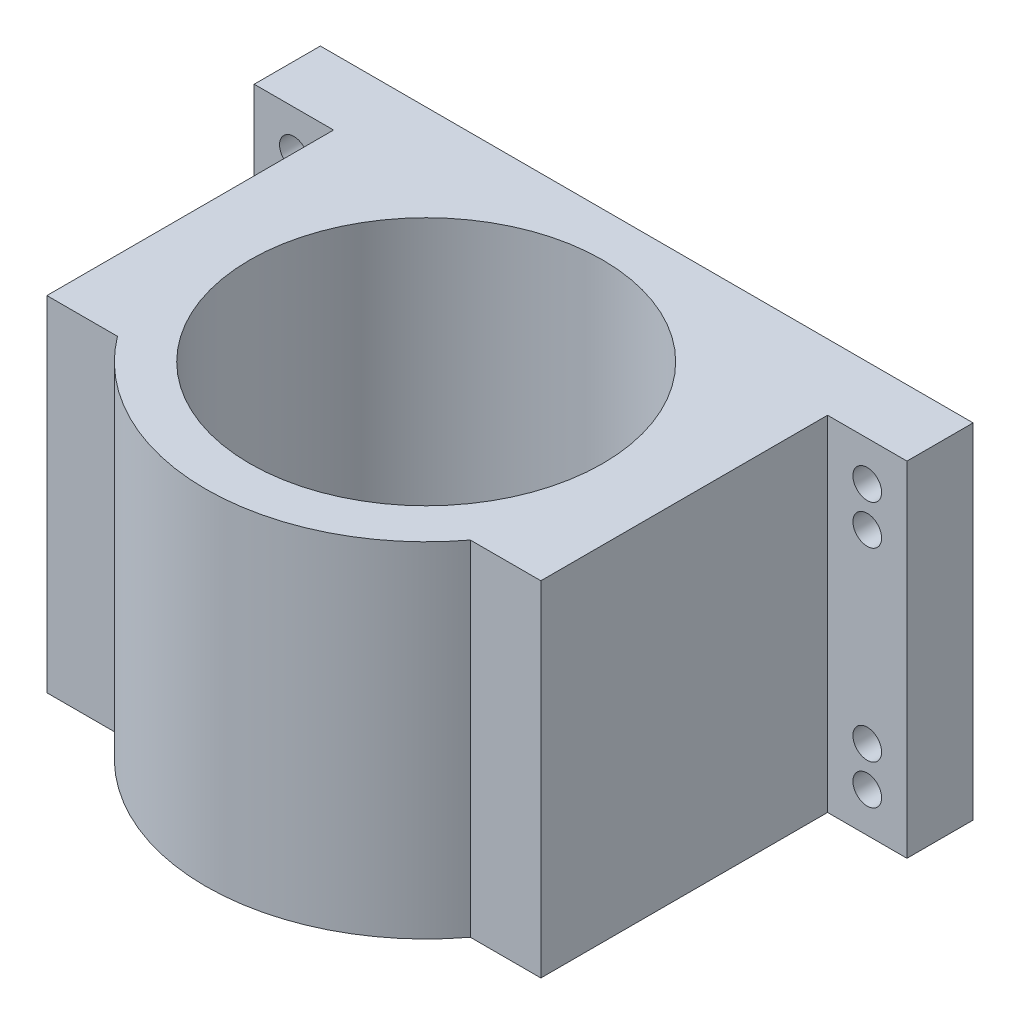
from build123d import *

# Parameters (mm, degrees)
SKETCH1_R                            = 40
BOSS_EXTRUDE1_DEPTH                  = 78
F_6_5_6_5_DIAMETER_HOLE1_D           = 6.5
MIRROR2_AT_THE_SECOND_PLANE_COPY_1_D = 6.5


with BuildPart() as part:
    # Sketch1 → Boss-Extrude1 (new body)
    with BuildSketch(Plane(origin=(0, 0, 0), x_dir=(1, 0, 0), z_dir=(0, 1, 0))):
        with BuildLine():
            Line((-74, 50), (-74, 35))
            Line((-74, 35), (-56, 35))
            Line((-56, 35), (-56, -30))
            Line((-56, -30), (-40, -30))
            ThreePointArc((-40, -30), (0, -50), (40, -30))
            Line((40, -30), (56, -30))
            Line((56, -30), (56, 35))
            Line((56, 35), (74, 35))
            Line((74, 35), (74, 50))
            Line((74, 50), (-74, 50))
        make_face()
        with Locations(Location((0, 0, 0), (0, 0, 270))):
            Circle(SKETCH1_R, mode=Mode.SUBTRACT)
    extrude(amount=BOSS_EXTRUDE1_DEPTH)

    # Ø6.5 (6.5) Diameter Hole1 (through all)
    with Locations(Plane(origin=(65, 69, -35), x_dir=(1, 0, 0), z_dir=(0, 0, 1))):
        with Locations((0, 0), (0, -9)):
            f_6_5_6_5_diameter_hole1 = Hole(F_6_5_6_5_DIAMETER_HOLE1_D / 2)

    # Mirror2: Ø6.5 (6.5) Diameter Hole1 across plane
    add(f_6_5_6_5_diameter_hole1.mirror(Plane.ZX.offset(39)), mode=Mode.SUBTRACT)

    # Mirror2 at the second plane: Ø6.5 (6.5) Diameter Hole1 across plane
    add(f_6_5_6_5_diameter_hole1.mirror(Plane(origin=(0, 0, 0), x_dir=(0, 0, 1), z_dir=(1, 0, 0))), mode=Mode.SUBTRACT)

    # Mirror2 at the second plane copy 1 (through all)
    with Locations(Plane(origin=(-65, 9, -35), x_dir=(-1, 0, 0), z_dir=(0, 0, 1))):
        with Locations((0, 0), (0, -9)):
            Hole(MIRROR2_AT_THE_SECOND_PLANE_COPY_1_D / 2)


solid = part.part
